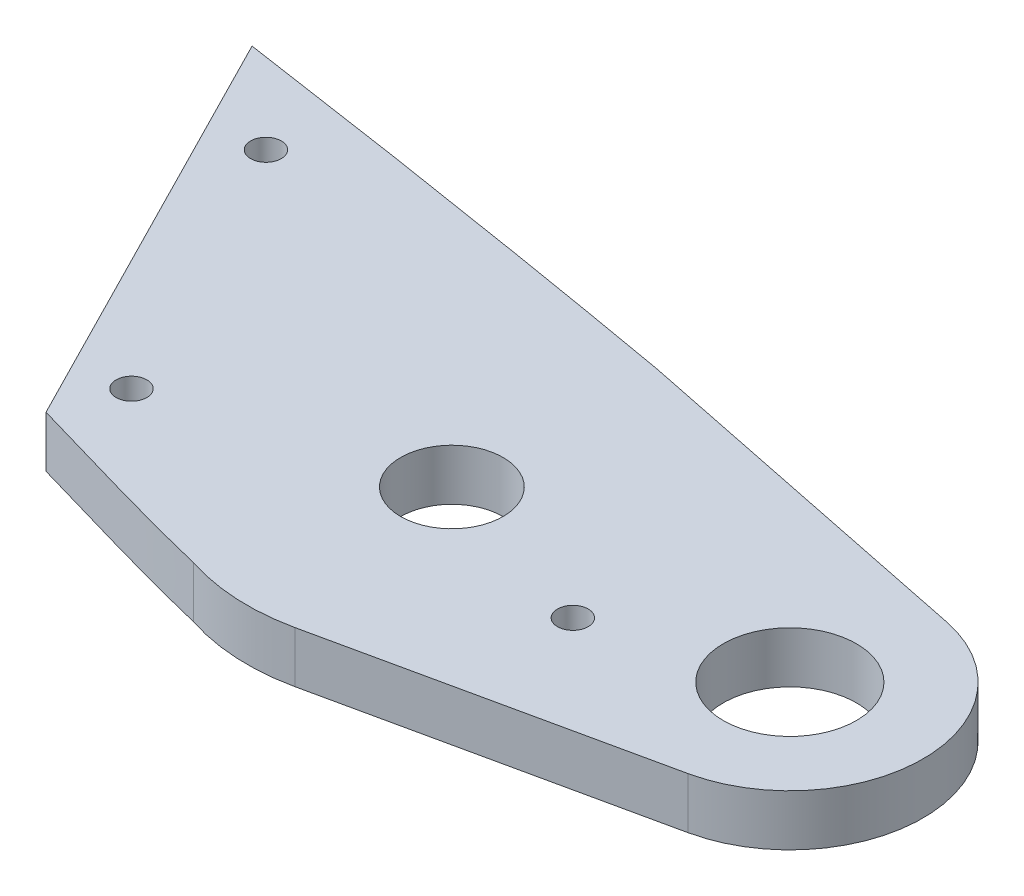
from build123d import *

# Parameters (mm, degrees)
BOSS_EXTRUDE1_DEPTH      = 20
BOSS_EXTRUDE1_DEPTH_BACK = 20
SKETCH1_R                = 5
SKETCH1_R_2              = 6.5
CUT_EXTRUDE4_DEPTH       = 35
SKETCH6_R                = 1.5
CUT_EXTRUDE5_DEPTH       = 10
CUT_EXTRUDE6_DEPTH       = 50


with BuildPart() as part:
    # Sketch1 → Boss-Extrude1 (new, two sides: drawn at the far end of the back side and taken through both)
    with BuildSketch(Plane(origin=(0, 0, 0), x_dir=(1, 0, 0), z_dir=(0, 1, 0)).offset(-BOSS_EXTRUDE1_DEPTH_BACK)):
        with BuildLine():
            add(Edge.make_bspline(
                [(0, 20), (-114.873131821, 40.378289836), (-300, 56.568542495), (-328.284271247, 28.284271247)],
                knots=[0.1900067, 0.1900067, 0.1900067, 0.1900067, 1.1900067, 1.1900067, 1.1900067, 1.1900067], degree=3))
            ThreePointArc((-328.284271247, 28.284271247), (-328.284271247, -28.284271247), (-271.715728753, -28.284271247))
            add(Edge.make_bspline(
                [(-271.715728753, -28.284271247), (-194.91847241, 48.512985095), (-42.964488834, -10.495172733), (-6.202879594, -19.013791961)],
                knots=[0, 0, 0, 0, 0.930923327, 0.930923327, 0.930923327, 0.930923327], degree=3))
            ThreePointArc((-6.202879594, -19.013791961), (-1.015557257, -19.974199445), (4.242424242, -19.544867269))
            Line((4.242424242, -19.544867269), (35.757575758, -12.704163725))
            ThreePointArc((35.757575758, -12.704163725), (45.999746115, 0.081246157), (35.598568909, 12.737638699))
            Line((35.598568909, 12.737638699), (0, 20))
        make_face()
        with Locations(Location((0, 0, 0), (0, 0, 270))):
            Circle(SKETCH1_R, mode=Mode.SUBTRACT)
        with Locations(Location((33, 0, 0), (0, 0, 270))):
            Circle(SKETCH1_R_2, mode=Mode.SUBTRACT)
    extrude(amount=BOSS_EXTRUDE1_DEPTH + BOSS_EXTRUDE1_DEPTH_BACK)

    # Sketch5 → Cut-Extrude4 (cut)
    with BuildSketch(Plane(origin=(0, 20, 0), x_dir=(1, 0, 0), z_dir=(0, 1, 0))):
        Polygon((-47.037049996, 27.527548523), (92.120786702, 16.164640032), (85.724700256, -16.918764701), (-17.262768022, -30.907770073), align=None)
    extrude(amount=-CUT_EXTRUDE4_DEPTH, mode=Mode.SUBTRACT)

    # Sketch6 → Cut-Extrude5 (cut)
    with BuildSketch(Plane(origin=(0, -20, 0), x_dir=(-1, 0, 0), z_dir=(0, -1, 0))):
        with Locations(Location((23.950772589, -7.329216823, 0), (0, 0, 90))):
            Circle(SKETCH6_R)
        with Locations(Location((-16.971180087, -5.159042993, 0), (0, 0, 90))):
            Circle(SKETCH6_R)
        with Locations(Location((37.588692144, 19.43670737, 0), (0, 0, 90))):
            Circle(SKETCH6_R)
    extrude(amount=-CUT_EXTRUDE5_DEPTH, mode=Mode.SUBTRACT)

    # Sketch7 → Cut-Extrude6 (cut)
    with BuildSketch(Plane(origin=(0, 20, 0), x_dir=(1, 0, 0), z_dir=(0, 1, 0))):
        Polygon((-47.037049996, 27.527548523), (-26.137658318, -13.489817144), (-379.595719096, -92.580220424), (-321.505561991, 137.254748988), align=None)
    extrude(amount=-CUT_EXTRUDE6_DEPTH, mode=Mode.SUBTRACT)


solid = part.part
